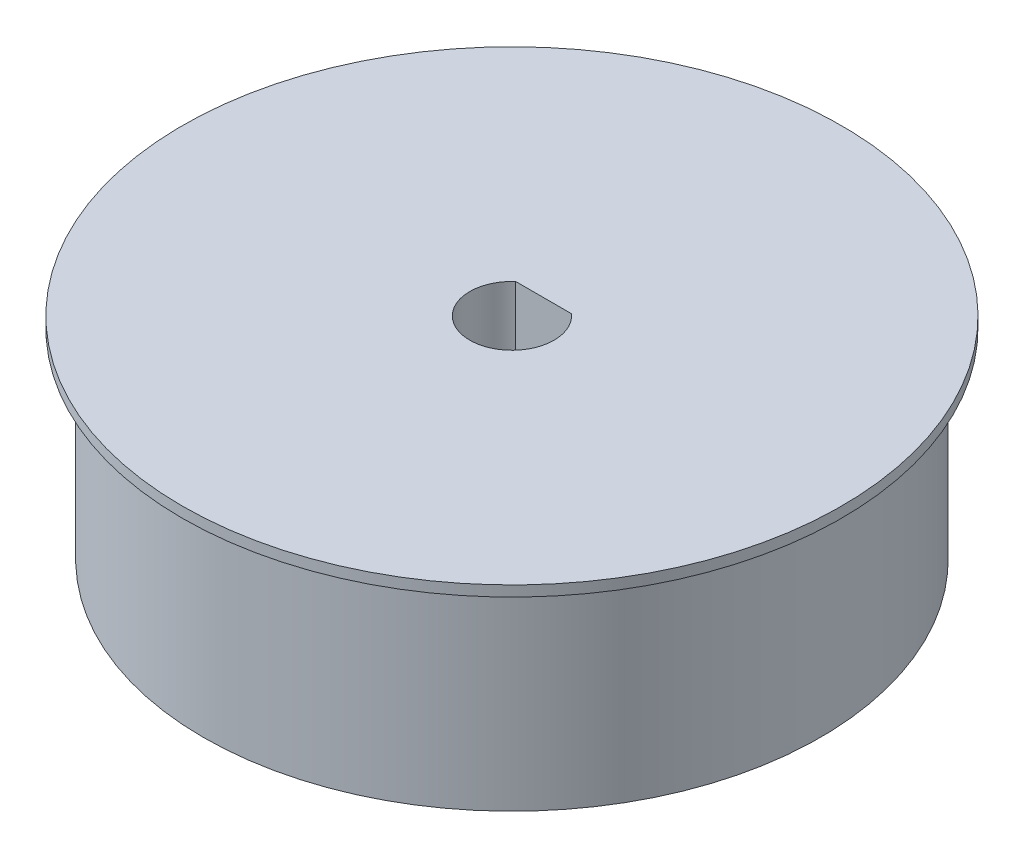
from build123d import *

# Parameters (mm, degrees)
SKETCH1_R           = 14.625
BOSS_EXTRUDE1_DEPTH = 10
BOSS_EXTRUDE2_START = -0.5
SKETCH2_R           = 15.625
BOSS_EXTRUDE2_DEPTH = 0.5


with BuildPart() as part:
    # Sketch1 → Boss-Extrude1 (new body)
    with BuildSketch(Plane(origin=(0, 0, 0), x_dir=(1, 0, 0), z_dir=(0, 1, 0))):
        with Locations(Location((0, 0, 0), (0, 0, 270))):
            Circle(SKETCH1_R)
        with BuildLine():
            Line((-1.322875656, 1.5), (1.322875656, 1.5))
            ThreePointArc((1.322875656, 1.5), (0, -2), (-1.322875656, 1.5))
        make_face(mode=Mode.SUBTRACT)
    extrude(amount=BOSS_EXTRUDE1_DEPTH)

    # Sketch2 → Boss-Extrude2 (add)
    with BuildSketch(Plane(origin=(0, 10, 0), x_dir=(1, 0, 0), z_dir=(0, 1, 0)).offset(BOSS_EXTRUDE2_START)):
        with Locations(Location((0, 0, 0), (0, 0, 270))):
            Circle(SKETCH2_R)
        with BuildLine():
            Line((-1.322875656, 1.5), (1.322875656, 1.5))
            ThreePointArc((1.322875656, 1.5), (0, -2), (-1.322875656, 1.5))
        make_face(mode=Mode.SUBTRACT)
    extrude(amount=BOSS_EXTRUDE2_DEPTH)


solid = part.part
